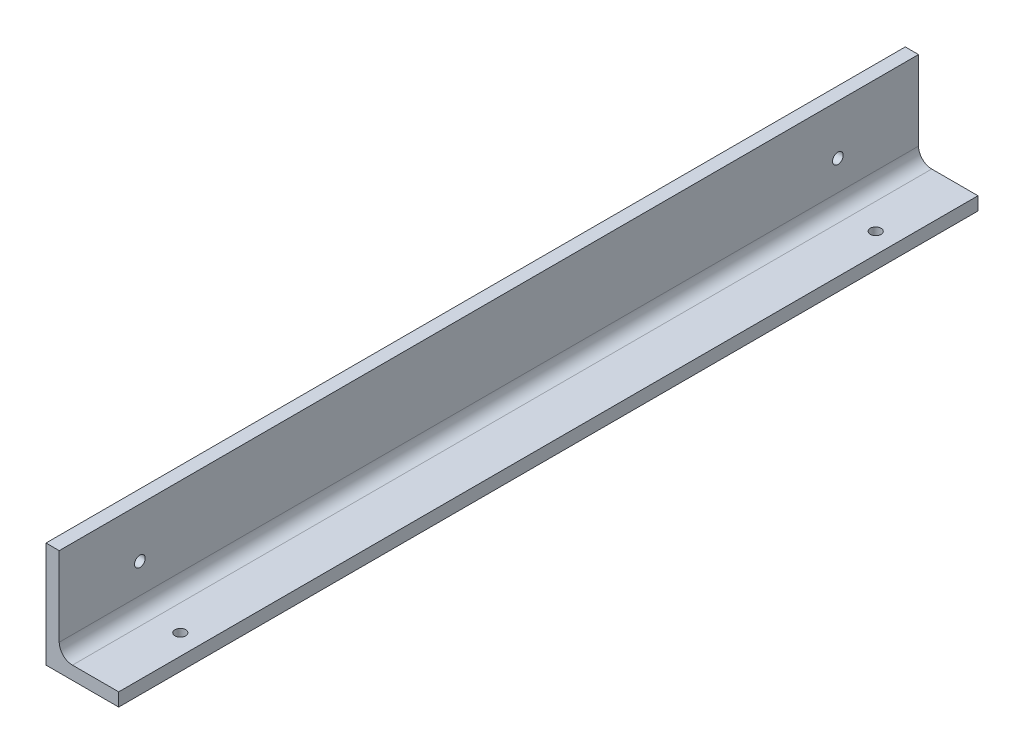
from build123d import *

# Parameters (mm, degrees)
BOSS_EXTRUDE1_DEPTH = 412.75
SKETCH2_R           = 2.5796875
CUT_EXTRUDE1_DEPTH  = 417.844974931
SKETCH3_R           = 2.5796875
CUT_EXTRUDE2_DEPTH  = 417.60307323


with BuildPart() as part:
    # Sketch1 → Boss-Extrude1 (new body)
    with BuildSketch(Plane.XY):
        with BuildLine():
            Line((0, 0), (0, 50.8))
            Line((0, 50.8), (6.35, 50.8))
            Line((6.35, 50.8), (6.35, 12.7))
            ThreePointArc((6.35, 12.7), (8.209871939, 8.209871939), (12.7, 6.35))
            Line((12.7, 6.35), (34.925, 6.35))
            Line((34.925, 6.35), (34.925, 0))
            Line((34.925, 0), (0, 0))
        make_face()
    extrude(amount=BOSS_EXTRUDE1_DEPTH)

    # Sketch2 → Cut-Extrude1 (cut, through all)
    with BuildSketch(Plane(origin=(6.35, 0, 0), x_dir=(0, 0, -1), z_dir=(1, 0, 0))):
        with Locations(Location((-374.015, 27.0002, 0), (0, 0, 90))):
            Circle(SKETCH2_R)
        with Locations(Location((-38.735, 26.9875, 0), (0, 0, 90))):
            Circle(SKETCH2_R)
    extrude(amount=-CUT_EXTRUDE1_DEPTH, mode=Mode.SUBTRACT)

    # Sketch3 → Cut-Extrude2 (cut, through all)
    with BuildSketch(Plane(origin=(0, 6.35, 0), x_dir=(1, 0, 0), z_dir=(0, 1, 0))):
        with Locations(Location((25.146, -373.38, 0), (0, 0, 180))):
            Circle(SKETCH3_R)
        with Locations(Location((25.146, -39.37, 0), (0, 0, 180))):
            Circle(SKETCH3_R)
    extrude(amount=-CUT_EXTRUDE2_DEPTH, mode=Mode.SUBTRACT)


solid = part.part
